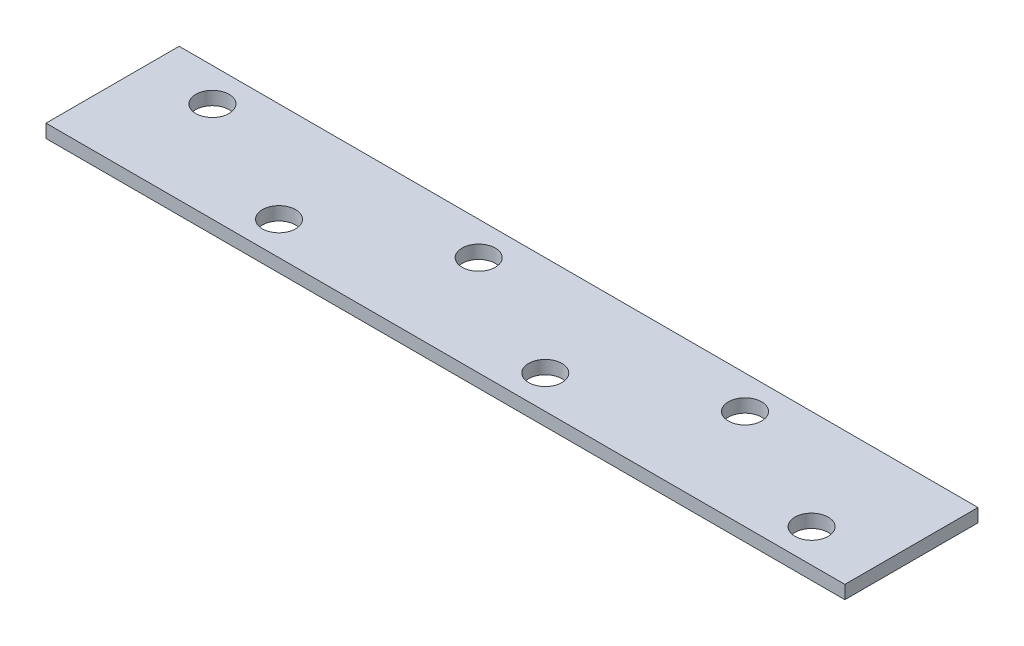
from build123d import *

# Parameters (mm, degrees)
SKETCH_2_W      = 120
SKETCH_2_H      = 20
SKETCH_2_R      = 2.5
EXTRUDE_1_DEPTH = 2


with BuildPart() as part:
    # Эскиз2 → Бобышка-Вытянуть1 (new body)
    with BuildSketch(Plane(origin=(0, 0, 0), x_dir=(1, 0, 0), z_dir=(0, 1, 0))):
        Rectangle(SKETCH_2_W, SKETCH_2_H)
        with Locations(Location((-50, 5, 0), (0, 0, 270))):
            Circle(SKETCH_2_R, mode=Mode.SUBTRACT)
        with Locations(Location((-10, 5, 0), (0, 0, 270))):
            Circle(SKETCH_2_R, mode=Mode.SUBTRACT)
        with Locations(Location((30, 5, 0), (0, 0, 270))):
            Circle(SKETCH_2_R, mode=Mode.SUBTRACT)
        with Locations(Location((-30, -5, 0), (0, 0, 270))):
            Circle(SKETCH_2_R, mode=Mode.SUBTRACT)
        with Locations(Location((10, -5, 0), (0, 0, 270))):
            Circle(SKETCH_2_R, mode=Mode.SUBTRACT)
        with Locations(Location((50, -5, 0), (0, 0, 270))):
            Circle(SKETCH_2_R, mode=Mode.SUBTRACT)
    extrude(amount=EXTRUDE_1_DEPTH)


solid = part.part
